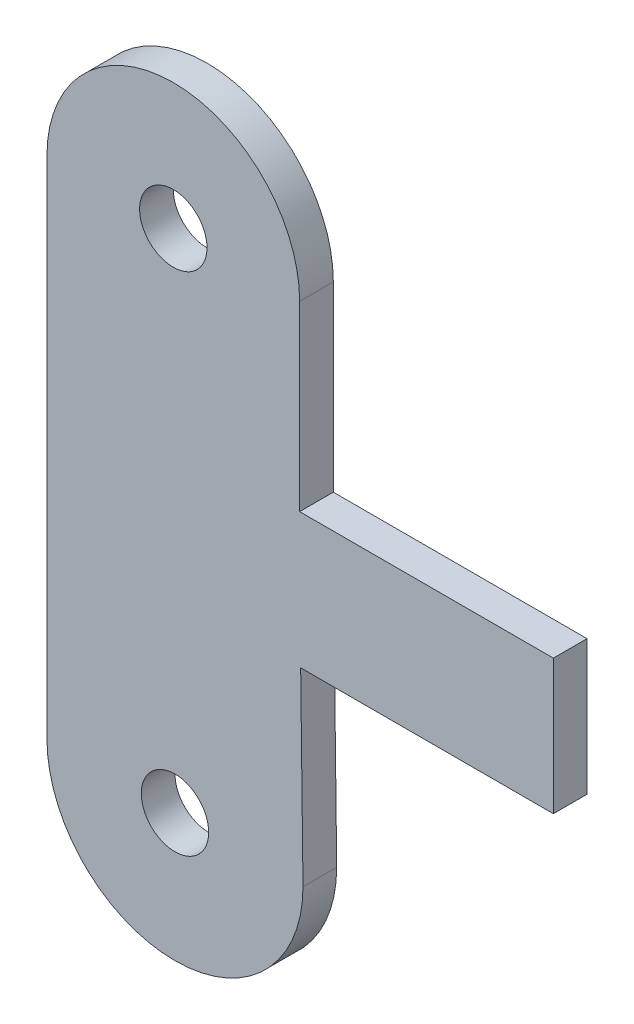
from build123d import *

# Parameters (mm, degrees)
SKETCH1_R           = 2
BOSS_EXTRUDE1_DEPTH = 2


with BuildPart() as part:
    # Sketch1 → Boss-Extrude1 (new body)
    with BuildSketch(Plane.XY):
        with BuildLine():
            Line((10.224721825, -6.524941173), (10.088449683, 4.475058827))
            Line((10.088449683, 4.475058827), (25.088449683, 4.475058827))
            Line((25.088449683, 4.475058827), (25.088449683, 12.475058827))
            Line((25.088449683, 12.475058827), (10.027054239, 12.475058827))
            Line((10.027054239, 12.475058827), (10.027054239, 23.2867844))
            ThreePointArc((10.027054239, 23.2867844), (2.527054239, 30.7867844), (-4.972945761, 23.2867844))
            Line((-4.972945761, 23.2867844), (-4.972945761, -6.7132156))
            ThreePointArc((-4.972945761, -6.7132156), (2.627054239, -14.3132156), (10.227054239, -6.7132156))
            Line((10.227054239, -6.7132156), (10.224721825, -6.524941173))
        make_face()
        with Locations((2.627054239, -6.7132156)):
            Circle(SKETCH1_R, mode=Mode.SUBTRACT)
        with Locations((2.527054239, 23.2867844)):
            Circle(SKETCH1_R, mode=Mode.SUBTRACT)
    extrude(amount=BOSS_EXTRUDE1_DEPTH)


solid = part.part
